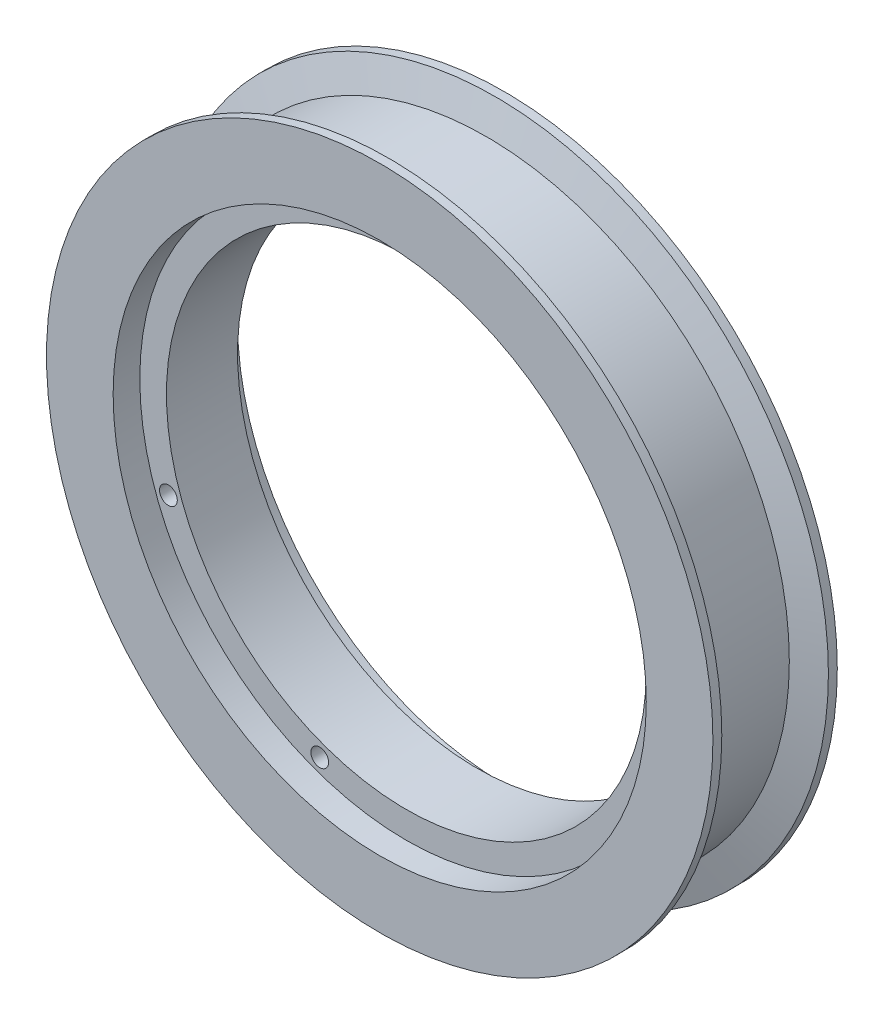
from build123d import *

# Parameters (mm, degrees)
SKETCH1_R           = 82.55
BOSS_EXTRUDE1_DEPTH = 25.4
SKETCH2_R           = 68.58
CUT_EXTRUDE1_DEPTH  = 25.4
SKETCH3_R           = 76.2
CUT_EXTRUDE2_DEPTH  = 2.54
CUT_EXTRUDE3_START  = -2.54
SKETCH4_R           = 76.2
CUT_EXTRUDE3_DEPTH  = 2.54
CHAMFER5_SIZE       = 0.254
CHAMFER6_SIZE       = 0.254
SKETCH6_R           = 2.54
CUT_EXTRUDE4_DEPTH  = 120.474537036
SKETCH7_R           = 95.25
SKETCH7_R_2         = 76.2
BOSS_EXTRUDE2_DEPTH = 25.4
SKETCH9_R           = 95.25
SKETCH9_R_2         = 76.2
BOSS_EXTRUDE3_DEPTH = 5.08


with BuildPart() as part:
    # Sketch1 → Boss-Extrude1 (new body)
    with BuildSketch(Plane.XY):
        Circle(SKETCH1_R)
    extrude(amount=BOSS_EXTRUDE1_DEPTH)

    # Sketch2 → Cut-Extrude1 (cut)
    with BuildSketch(Plane.XY):
        Circle(SKETCH2_R)
    extrude(amount=CUT_EXTRUDE1_DEPTH, mode=Mode.SUBTRACT)

    # Sketch3 → Cut-Extrude2 (cut)
    with BuildSketch(Plane.XY):
        Circle(SKETCH3_R)
    extrude(amount=CUT_EXTRUDE2_DEPTH, mode=Mode.SUBTRACT)

    # Sketch4 → Cut-Extrude3 (cut)
    with BuildSketch(Plane.XY.offset(25.4).offset(CUT_EXTRUDE3_START)):
        Circle(SKETCH4_R)
    extrude(amount=CUT_EXTRUDE3_DEPTH, mode=Mode.SUBTRACT)

    # Chamfer5
    chamfer5_edges = [part.edges().sort_by_distance(p)[0] for p in [
        (-82.55, 0, 0),
    ]]
    chamfer(chamfer5_edges, length=CHAMFER5_SIZE)

    # Chamfer6
    chamfer6_edges = [part.edges().sort_by_distance(p)[0] for p in [
        (-82.55, 0, 25.4),
    ]]
    chamfer(chamfer6_edges, length=CHAMFER6_SIZE)

    # Sketch6 → Cut-Extrude4 (cut, through all)
    with BuildSketch(Plane.XY):
        with Locations((68.024348819, 24.758838175)):
            Circle(SKETCH6_R)
        with Locations((-68.024348819, -24.758838175)):
            Circle(SKETCH6_R)
        with Locations((24.758838175, 68.024348819)):
            Circle(SKETCH6_R)
        with Locations((-24.758838175, -68.024348819)):
            Circle(SKETCH6_R)
    extrude(amount=CUT_EXTRUDE4_DEPTH, mode=Mode.SUBTRACT)

    # Sketch7 → Boss-Extrude2 (add)
    with BuildSketch(Plane(origin=(0, 0, 0), x_dir=(-1, 0, 0), z_dir=(0, 0, -1))):
        Circle(SKETCH7_R)
        with Locations(Location((0, 0, 0), (0, 0, 180))):
            Circle(SKETCH7_R_2, mode=Mode.SUBTRACT)
    extrude(amount=-BOSS_EXTRUDE2_DEPTH)

    # Sketch9 → Boss-Extrude3 (add)
    with BuildSketch(Plane.XY.offset(25.4)):
        with Locations(Location((0, 0, 0), (0, 0, 180))):
            Circle(SKETCH9_R)
        Circle(SKETCH9_R_2, mode=Mode.SUBTRACT)
    boss_extrude3 = extrude(amount=BOSS_EXTRUDE3_DEPTH)

    # Mirror1: Boss-Extrude3 across plane
    add(boss_extrude3.mirror(Plane(origin=(0, 0, 12.7), x_dir=(1, 0, 0), z_dir=(0, 0, -1))))

    # Sketch10 → Cut-Revolve1 (revolve, cut)
    with BuildSketch(Plane(origin=(0, 0, 0), x_dir=(0, 0, -1), z_dir=(1, 0, 0)), mode=Mode.PRIVATE) as cut_revolve1_sk:
        Polygon((0, 86.614), (-25.4, 86.614), (-27.94, 95.25), (2.54, 95.25), align=None)
    revolve(cut_revolve1_sk.sketch.rotate(Axis((0, 0, 22.86), (0, 0, -1)), 90), axis=Axis((0, 0, 22.86), (0, 0, -1)), mode=Mode.SUBTRACT)


solid = part.part
